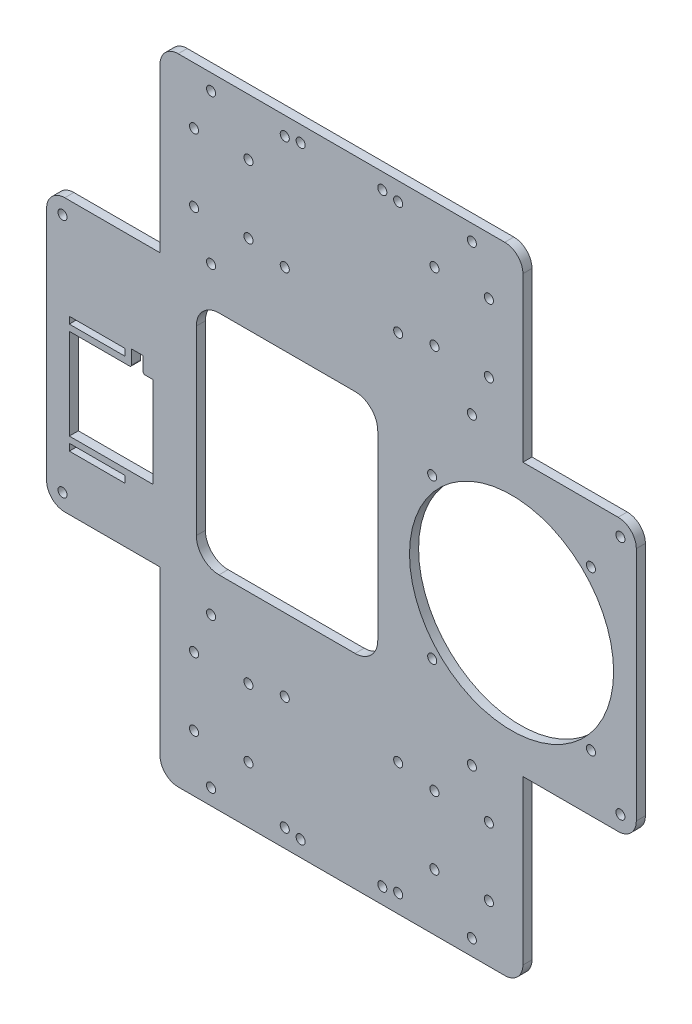
from build123d import *

# Parameters (mm, degrees)
SKETCH_1_R          = 2
SKETCH_1_W          = 35
SKETCH_1_H          = 40
SKETCH_1_H_2        = 3
SKETCH_1_R_2        = 45
EXTRUDE_3_DEPTH     = 4
FILLET_1_R          = 8
SKETCH_4_R          = 2
CUT_EXTRUDE_3_DEPTH = 4
SKETCH_6_R          = 2
CUT_EXTRUDE_5_DEPTH = 10
SKETCH_7_W          = 80
SKETCH_7_H          = 100
CUT_EXTRUDE_6_DEPTH = 10
FILLET_2_R          = 10
SKETCH_8_W          = 3
SKETCH_8_H          = 7
EXTRUDE_5_DEPTH     = 4
SKETCH_8_4_W        = 5
SKETCH_8_4_H        = 7
CUT_EXTRUDE_7_DEPTH = 4
SKETCH_9_W          = 2
SKETCH_9_H          = 3
SKETCH_9_H_2        = 40
CUT_EXTRUDE_8_DEPTH = 4
FILLET_3_R          = 1


with BuildPart() as part:
    # 草图1 → 凸台-拉伸3 (new body)
    with BuildSketch(Plane.XY):
        Polygon((123.0688133, -57.848092329), (123.0688133, 62.151907671), (73.0688133, 62.151907671), (73.0688133, 142.151907671), (-86.9311867, 142.151907671), (-86.9311867, 62.151907671), (-136.9311867, 62.151907671), (-136.9311867, -57.848092329), (-86.9311867, -57.848092329), (-86.9311867, -137.848092329), (73.0688133, -137.848092329), (73.0688133, -57.848092329), align=None)
        with Locations((-71.9311867, -112.848092329)):
            Circle(SKETCH_1_R, mode=Mode.SUBTRACT)
        with Locations((-71.9311867, -82.848092329)):
            Circle(SKETCH_1_R, mode=Mode.SUBTRACT)
        with Locations((-107.4311867, -7.848092329)):
            Rectangle(SKETCH_1_W, SKETCH_1_H, mode=Mode.SUBTRACT)
        with Locations((-107.4311867, -32.098092329)):
            Rectangle(SKETCH_1_W, SKETCH_1_H_2, mode=Mode.SUBTRACT)
        with Locations((68.0688133, 2.151907671)):
            Circle(SKETCH_1_R_2, mode=Mode.SUBTRACT)
        with Locations((33.0688133, -32.848092329)):
            Circle(SKETCH_1_R, mode=Mode.SUBTRACT)
        with Locations((103.0688133, -32.848092329)):
            Circle(SKETCH_1_R, mode=Mode.SUBTRACT)
        with Locations((-64.4311867, -64.848092329)):
            Circle(SKETCH_1_R, mode=Mode.SUBTRACT)
        with Locations((-64.4311867, -130.848092329)):
            Circle(SKETCH_1_R, mode=Mode.SUBTRACT)
        with Locations((-31.9311867, -129.848092329)):
            Circle(SKETCH_1_R, mode=Mode.SUBTRACT)
        with Locations((18.0688133, -129.848092329)):
            Circle(SKETCH_1_R, mode=Mode.SUBTRACT)
        with Locations((50.5688133, -130.848092329)):
            Circle(SKETCH_1_R, mode=Mode.SUBTRACT)
        with Locations((58.0688133, -112.848092329)):
            Circle(SKETCH_1_R, mode=Mode.SUBTRACT)
        with Locations((58.0688133, -82.848092329)):
            Circle(SKETCH_1_R, mode=Mode.SUBTRACT)
        with Locations((50.5688133, -64.848092329)):
            Circle(SKETCH_1_R, mode=Mode.SUBTRACT)
        with Locations((-47.9311867, -82.848092329)):
            Circle(SKETCH_1_R, mode=Mode.SUBTRACT)
        with Locations((-47.9311867, -112.848092329)):
            Circle(SKETCH_1_R, mode=Mode.SUBTRACT)
        with Locations((58.0688133, 117.151907671)):
            Circle(SKETCH_1_R, mode=Mode.SUBTRACT)
        with Locations((103.0688133, 37.151907671)):
            Circle(SKETCH_1_R, mode=Mode.SUBTRACT)
        with Locations((33.0688133, 37.151907671)):
            Circle(SKETCH_1_R, mode=Mode.SUBTRACT)
        with Locations((-107.4311867, 16.401907671)):
            Rectangle(SKETCH_1_W, SKETCH_1_H_2, mode=Mode.SUBTRACT)
        with Locations((50.5688133, 135.151907671)):
            Circle(SKETCH_1_R, mode=Mode.SUBTRACT)
        with Locations((-64.4311867, 135.151907671)):
            Circle(SKETCH_1_R, mode=Mode.SUBTRACT)
        with Locations((-71.9311867, 117.151907671)):
            Circle(SKETCH_1_R, mode=Mode.SUBTRACT)
        with Locations((-71.9311867, 87.151907671)):
            Circle(SKETCH_1_R, mode=Mode.SUBTRACT)
        with Locations((-64.4311867, 69.151907671)):
            Circle(SKETCH_1_R, mode=Mode.SUBTRACT)
        with Locations((50.5688133, 69.151907671)):
            Circle(SKETCH_1_R, mode=Mode.SUBTRACT)
        with Locations((58.0688133, 87.151907671)):
            Circle(SKETCH_1_R, mode=Mode.SUBTRACT)
        with Locations((34.0688133, -82.848092329)):
            Circle(SKETCH_1_R, mode=Mode.SUBTRACT)
        with Locations((34.0688133, -112.848092329)):
            Circle(SKETCH_1_R, mode=Mode.SUBTRACT)
        with Locations((18.0688133, -79.848092329)):
            Circle(SKETCH_1_R, mode=Mode.SUBTRACT)
        with Locations((-31.9311867, -79.848092329)):
            Circle(SKETCH_1_R, mode=Mode.SUBTRACT)
        with Locations((34.0688133, 117.151907671)):
            Circle(SKETCH_1_R, mode=Mode.SUBTRACT)
        with Locations((34.0688133, 87.151907671)):
            Circle(SKETCH_1_R, mode=Mode.SUBTRACT)
        with Locations((-47.9311867, 87.151907671)):
            Circle(SKETCH_1_R, mode=Mode.SUBTRACT)
        with Locations((-47.9311867, 117.151907671)):
            Circle(SKETCH_1_R, mode=Mode.SUBTRACT)
    extrude(amount=EXTRUDE_3_DEPTH)

    # 圆角1
    fillet_1_edges = [part.edges().sort_by_distance(p)[0] for p in [
        (-136.9311867, -57.848092329, 2),
        (-86.9311867, -137.848092329, 2),
        (73.0688133, -137.848092329, 2),
        (123.0688133, -57.848092329, 2),
        (123.0688133, 62.151907671, 2),
        (73.0688133, 142.151907671, 2),
        (-86.9311867, 142.151907671, 2),
        (-136.9311867, 62.151907671, 2),
    ]]
    fillet(fillet_1_edges, radius=FILLET_1_R)

    # 草图4 → 切除-拉伸3 (cut)
    with BuildSketch(Plane.XY.offset(4)):
        with Locations((-129.9311867, 55.151907671)):
            Circle(SKETCH_4_R)
        with Locations((-129.9311867, -50.848092329)):
            Circle(SKETCH_4_R)
        with Locations((116.0688133, 55.151907671)):
            Circle(SKETCH_4_R)
        with Locations((116.0688133, -50.848092329)):
            Circle(SKETCH_4_R)
        with Locations((-24.9311867, 135.151907671)):
            Circle(SKETCH_4_R)
        with Locations((11.0688133, 135.151907671)):
            Circle(SKETCH_4_R)
        with Locations((-24.9311867, -130.848092329)):
            Circle(SKETCH_4_R)
        with Locations((11.0688133, -130.848092329)):
            Circle(SKETCH_4_R)
    extrude(amount=-CUT_EXTRUDE_3_DEPTH, mode=Mode.SUBTRACT)

    # 草图6 → 切除-拉伸5 (cut)
    with BuildSketch(Plane.XY.offset(4)):
        with Locations((-31.9311867, 134.151907671)):
            Circle(SKETCH_6_R)
        with Locations((18.0688133, 134.151907671)):
            Circle(SKETCH_6_R)
        with Locations((-31.9311867, 84.151907671)):
            Circle(SKETCH_6_R)
        with Locations((18.0688133, 84.151907671)):
            Circle(SKETCH_6_R)
    extrude(amount=-CUT_EXTRUDE_5_DEPTH, mode=Mode.SUBTRACT)

    # 草图7 → 切除-拉伸6 (cut)
    with BuildSketch(Plane.XY.offset(4)):
        with Locations((-30.9311867, 2.151907671)):
            Rectangle(SKETCH_7_W, SKETCH_7_H)
    extrude(amount=-CUT_EXTRUDE_6_DEPTH, mode=Mode.SUBTRACT)

    # 圆角2
    fillet_2_edges = [part.edges().sort_by_distance(p)[0] for p in [
        (9.0688133, 52.151907671, 2),
        (9.0688133, -47.848092329, 2),
        (-70.9311867, -47.848092329, 2),
        (-70.9311867, 52.151907671, 2),
    ]]
    fillet(fillet_2_edges, radius=FILLET_2_R)

    # 草图8 → 凸台-拉伸5 (add)
    with BuildSketch(Plane(origin=(0, 0, 0), x_dir=(-1, 0, 0), z_dir=(0, 0, -1))):
        Polygon((86.9311867, -33.598092329), (102.4311867, -33.598092329), (102.4311867, -27.848092329), (89.9311867, -27.848092329), (89.9311867, 12.151907671), (94.4311867, 12.151907671), (94.4311867, 19.151907671), (86.9311867, 19.151907671), align=None)
        with Locations((100.9311867, 15.651907671)):
            Rectangle(SKETCH_8_W, SKETCH_8_H)
    extrude(amount=-EXTRUDE_5_DEPTH)

    # 草图8<4> → 切除-拉伸7 (cut)
    with BuildSketch(Plane(origin=(0, 0, 0), x_dir=(-1, 0, 0), z_dir=(0, 0, -1))):
        with Locations((96.9311867, 15.651907671)):
            Rectangle(SKETCH_8_4_W, SKETCH_8_4_H)
    extrude(amount=-CUT_EXTRUDE_7_DEPTH, mode=Mode.SUBTRACT)

    # 草图9 → 切除-拉伸8 (cut)
    with BuildSketch(Plane(origin=(0, 0, 0), x_dir=(-1, 0, 0), z_dir=(0, 0, -1))):
        with Locations((125.9311867, 16.401907671)):
            Rectangle(SKETCH_9_W, SKETCH_9_H)
        with Locations((125.9311867, -32.098092329)):
            Rectangle(SKETCH_9_W, SKETCH_9_H)
        with Locations((125.9311867, -7.848092329)):
            Rectangle(SKETCH_9_W, SKETCH_9_H_2)
    extrude(amount=-CUT_EXTRUDE_8_DEPTH, mode=Mode.SUBTRACT)

    # 圆角3
    fillet_3_edges = [part.edges().sort_by_distance(p)[0] for p in [
        (-99.4311867, 12.151907671, 2),
        (-94.4311867, 12.151907671, 2),
    ]]
    fillet(fillet_3_edges, radius=FILLET_3_R)


solid = part.part
